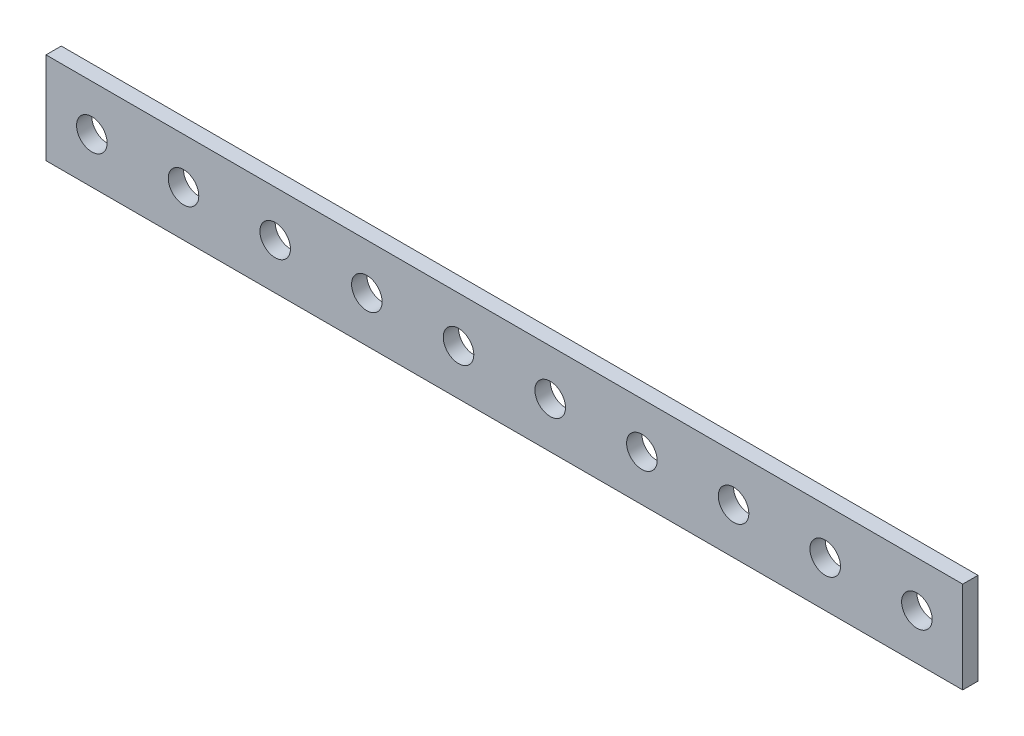
from build123d import *

# Parameters (mm, degrees)
SKETCH1_W           = 30
SKETCH1_H           = 3
SKETCH1_R           = 0.5
BOSS_EXTRUDE1_DEPTH = 0.5


with BuildPart() as part:
    # Sketch1 → Boss-Extrude1 (new body)
    with BuildSketch(Plane.XY):
        with Locations((13.5, 0)):
            Rectangle(SKETCH1_W, SKETCH1_H)
        Circle(SKETCH1_R, mode=Mode.SUBTRACT)
        with Locations((3, 0)):
            Circle(SKETCH1_R, mode=Mode.SUBTRACT)
        with Locations((6, 0)):
            Circle(SKETCH1_R, mode=Mode.SUBTRACT)
        with Locations((9, 0)):
            Circle(SKETCH1_R, mode=Mode.SUBTRACT)
        with Locations((12, 0)):
            Circle(SKETCH1_R, mode=Mode.SUBTRACT)
        with Locations((15, 0)):
            Circle(SKETCH1_R, mode=Mode.SUBTRACT)
        with Locations((18, 0)):
            Circle(SKETCH1_R, mode=Mode.SUBTRACT)
        with Locations((21, 0)):
            Circle(SKETCH1_R, mode=Mode.SUBTRACT)
        with Locations((24, 0)):
            Circle(SKETCH1_R, mode=Mode.SUBTRACT)
        with Locations((27, 0)):
            Circle(SKETCH1_R, mode=Mode.SUBTRACT)
    extrude(amount=-BOSS_EXTRUDE1_DEPTH)


solid = part.part
